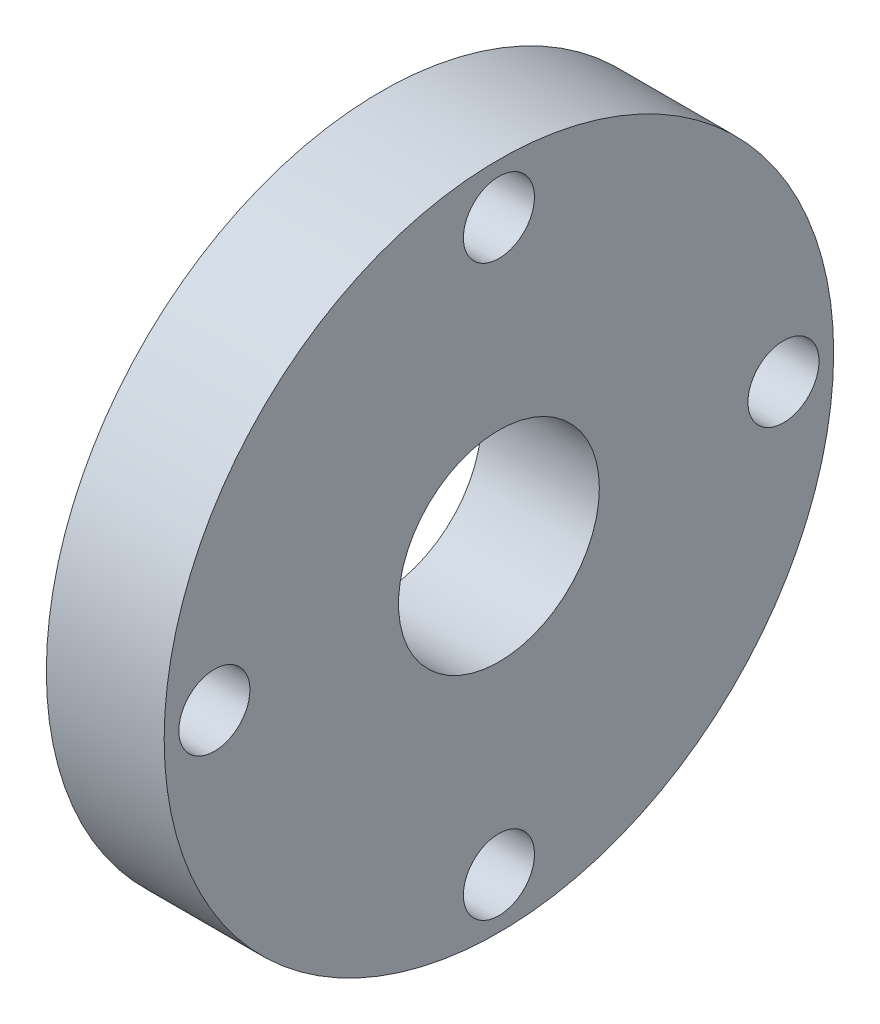
from build123d import *

# Parameters (mm, degrees)
SKETCH1_W           = 63.5
SKETCH1_H           = 22.352
CUT_EXTRUDE2_START  = 22.352
SKETCH2_R           = 19.05
CUT_EXTRUDE2_DEPTH  = 115.894487021
CUT_EXTRUDE4_START  = 22.352
SKETCH3_R           = 4.3688
CUT_EXTRUDE4_DEPTH  = 127
CUT_EXTRUDE6_START  = 22.352
SKETCH4_R           = 6.7437
CUT_EXTRUDE6_DEPTH  = 9.652
CUT_EXTRUDE8_START  = 22.352
SKETCH5_R           = 4.3688
CUT_EXTRUDE8_DEPTH  = 127
CUT_EXTRUDE10_START = 22.352
SKETCH6_R           = 6.7437
CUT_EXTRUDE10_DEPTH = 9.652


with BuildPart() as part:
    # Sketch1 → Revolve1 (revolve)
    with BuildSketch(Plane(origin=(0, 0, 0), x_dir=(0, 1, 0), z_dir=(0, 0, 1)), mode=Mode.PRIVATE) as revolve1_sk:
        with Locations((31.75, -11.176)):
            Rectangle(SKETCH1_W, SKETCH1_H)
    revolve(revolve1_sk.sketch.rotate(Axis((-25.4, 0, 0), (1, 0, 0)), 90), axis=Axis((-25.4, 0, 0), (1, 0, 0)))

    # Sketch2 → Cut-Extrude2 (cut, through all)
    with BuildSketch(Plane.YZ.offset(CUT_EXTRUDE2_START)):
        with Locations(Location((0, 0, 0), (0, 0, 270))):
            Circle(SKETCH2_R)
    extrude(amount=-CUT_EXTRUDE2_DEPTH, mode=Mode.SUBTRACT)

    # Sketch3 → Cut-Extrude4 (cut)
    with BuildSketch(Plane.YZ.offset(CUT_EXTRUDE4_START)):
        with Locations(Location((53.975, 0, 0), (0, 0, 270))):
            Circle(SKETCH3_R)
    extrude(amount=-CUT_EXTRUDE4_DEPTH, mode=Mode.SUBTRACT)

    # Sketch4 → Cut-Extrude6 (cut)
    with BuildSketch(Plane.YZ.offset(CUT_EXTRUDE6_START)):
        with Locations(Location((53.975, 0, 0), (0, 0, 270))):
            Circle(SKETCH4_R)
    extrude(amount=-CUT_EXTRUDE6_DEPTH, mode=Mode.SUBTRACT)

    # Sketch5 → Cut-Extrude8 (cut)
    with BuildSketch(Plane.YZ.offset(CUT_EXTRUDE8_START)):
        with Locations(Location((0, 53.975, 0), (0, 0, 270))):
            Circle(SKETCH5_R)
        with Locations(Location((-53.975, 0, 0), (0, 0, 270))):
            Circle(SKETCH5_R)
        with Locations(Location((0, -53.975, 0), (0, 0, 270))):
            Circle(SKETCH5_R)
    extrude(amount=-CUT_EXTRUDE8_DEPTH, mode=Mode.SUBTRACT)

    # Sketch6 → Cut-Extrude10 (cut)
    with BuildSketch(Plane.YZ.offset(CUT_EXTRUDE10_START)):
        with Locations(Location((0, 53.975, 0), (0, 0, 270))):
            Circle(SKETCH6_R)
        with Locations(Location((-53.975, 0, 0), (0, 0, 270))):
            Circle(SKETCH6_R)
        with Locations(Location((0, -53.975, 0), (0, 0, 270))):
            Circle(SKETCH6_R)
    extrude(amount=-CUT_EXTRUDE10_DEPTH, mode=Mode.SUBTRACT)


solid = part.part
